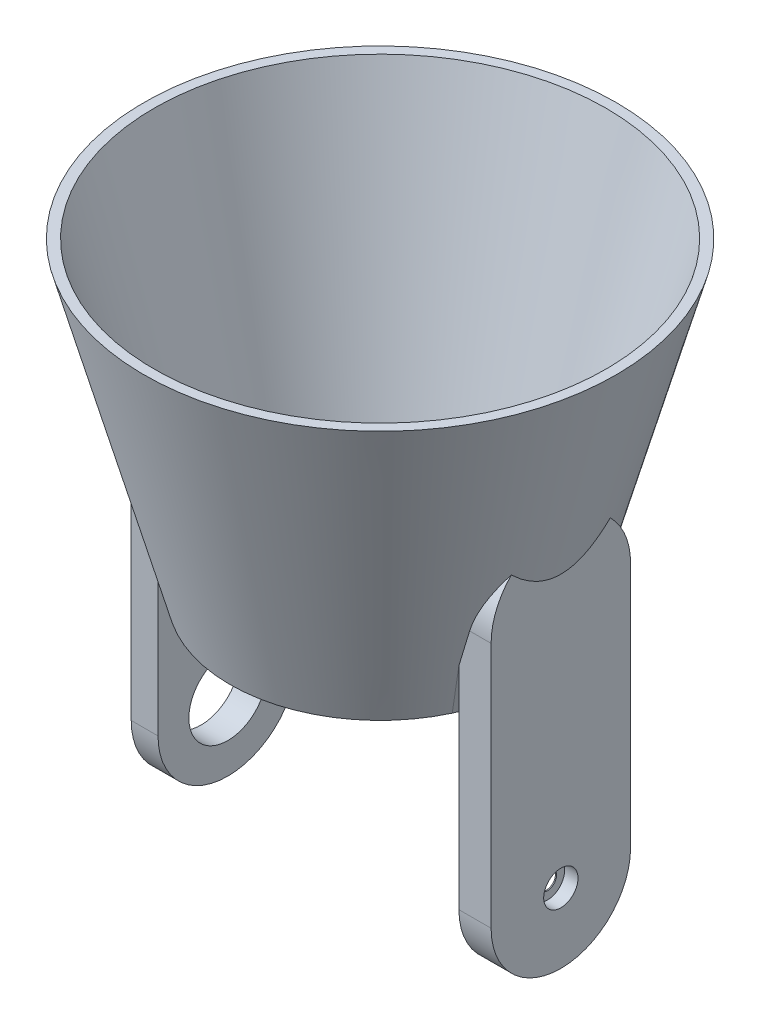
from build123d import *

# Parameters (mm, degrees)
DRIVE_START           = 27.7
DRIVE_ARM_DEPTH       = 6
IDLER_START           = -33.4
IDLER_ARM_DEPTH       = 5
HORN_START            = 27.5
HORN_POCKET_DEPTH     = 3.5
HUB_START             = 27.5
SKETCH6_R             = 7.6
HUB_RELIEF_DEPTH      = 1.4
SKETCH7_R             = 1.7
HUB_BOLT_DEPTH        = 6.4
HUB_START_2           = 31.2
SKETCH8_R             = 3.2
HUB_COUNTERBORE_DEPTH = 2.7
IDLER_START_2         = -33.6
SKETCH9_R             = 7.25
IDLER_BORE_DEPTH      = 5.4


with BuildPart() as part:
    # Sketch1 → Cone (revolve)
    with BuildSketch(Plane.XY, mode=Mode.PRIVATE) as cone_sk:
        Polygon((3.5, 30), (28, 30), (44, 88), (42.132765785, 88), (26.684489923, 32), (3.5, 32), align=None)
    revolve(cone_sk.sketch.rotate(Axis((0, 0, 0), (0, 1, 0)), 90), axis=Axis((0, 0, 0), (0, 1, 0)))

    # Sketch2 → Drive arm (add)
    with BuildSketch(Plane(origin=(0, 0, 0), x_dir=(0, 0, -1), z_dir=(1, 0, 0)).offset(DRIVE_START)):
        with BuildLine():
            Line((-13, 0), (-13, 46))
            ThreePointArc((-13, 46), (0, 59), (13, 46))
            Line((13, 46), (13, 0))
            ThreePointArc((13, 0), (0, -13), (-13, 0))
        make_face()
    extrude(amount=DRIVE_ARM_DEPTH)

    # Sketch3 → Idler arm (add)
    with BuildSketch(Plane(origin=(0, 0, 0), x_dir=(0, 0, -1), z_dir=(1, 0, 0)).offset(IDLER_START)):
        with BuildLine():
            Line((-13, 0), (-13, 46))
            ThreePointArc((-13, 46), (0, 59), (13, 46))
            Line((13, 46), (13, 0))
            ThreePointArc((13, 0), (0, -13), (-13, 0))
        make_face()
    extrude(amount=IDLER_ARM_DEPTH)

    # Sketch4 → Hollow (revolve, cut)
    with BuildSketch(Plane.XY, mode=Mode.PRIVATE) as hollow_sk:
        Polygon((0, 32), (26.684489923, 32), (42.408627854, 89), (0, 89), align=None)
    revolve(hollow_sk.sketch.rotate(Axis((0, 0, 0), (0, 1, 0)), 334.858673759), axis=Axis((0, 0, 0), (0, 1, 0)), mode=Mode.SUBTRACT)

    # Sketch5 → Horn pocket (cut)
    with BuildSketch(Plane(origin=(0, 0, 0), x_dir=(0, 0, -1), z_dir=(1, 0, 0)).offset(HORN_START)):
        with BuildLine():
            Line((-4.4, -11.1), (-4.4, 11.1))
            ThreePointArc((-4.4, 11.1), (0, 15.5), (4.4, 11.1))
            Line((4.4, 11.1), (4.4, -11.1))
            ThreePointArc((4.4, -11.1), (0, -15.5), (-4.4, -11.1))
        make_face()
    extrude(amount=HORN_POCKET_DEPTH, mode=Mode.SUBTRACT)

    # Sketch6 → Hub relief (cut)
    with BuildSketch(Plane(origin=(0, 0, 0), x_dir=(0, 0, -1), z_dir=(1, 0, 0)).offset(HUB_START)):
        Circle(SKETCH6_R)
    extrude(amount=HUB_RELIEF_DEPTH, mode=Mode.SUBTRACT)

    # Sketch7 → Hub bolt (cut)
    with BuildSketch(Plane(origin=(0, 0, 0), x_dir=(0, 0, -1), z_dir=(1, 0, 0)).offset(HUB_START)):
        with Locations(Location((0, 0, 0), (0, 0, 180))):
            Circle(SKETCH7_R)
    extrude(amount=HUB_BOLT_DEPTH, mode=Mode.SUBTRACT)

    # Sketch8 → Hub counterbore (cut)
    with BuildSketch(Plane(origin=(0, 0, 0), x_dir=(0, 0, -1), z_dir=(1, 0, 0)).offset(HUB_START_2)):
        with Locations(Location((0, 0, 0), (0, 0, 180))):
            Circle(SKETCH8_R)
    extrude(amount=HUB_COUNTERBORE_DEPTH, mode=Mode.SUBTRACT)

    # Sketch9 → Idler bore (cut)
    with BuildSketch(Plane(origin=(0, 0, 0), x_dir=(0, 0, -1), z_dir=(1, 0, 0)).offset(IDLER_START_2)):
        with Locations(Location((0, 0, 0), (0, 0, 180))):
            Circle(SKETCH9_R)
    extrude(amount=IDLER_BORE_DEPTH, mode=Mode.SUBTRACT)


solid = part.part
